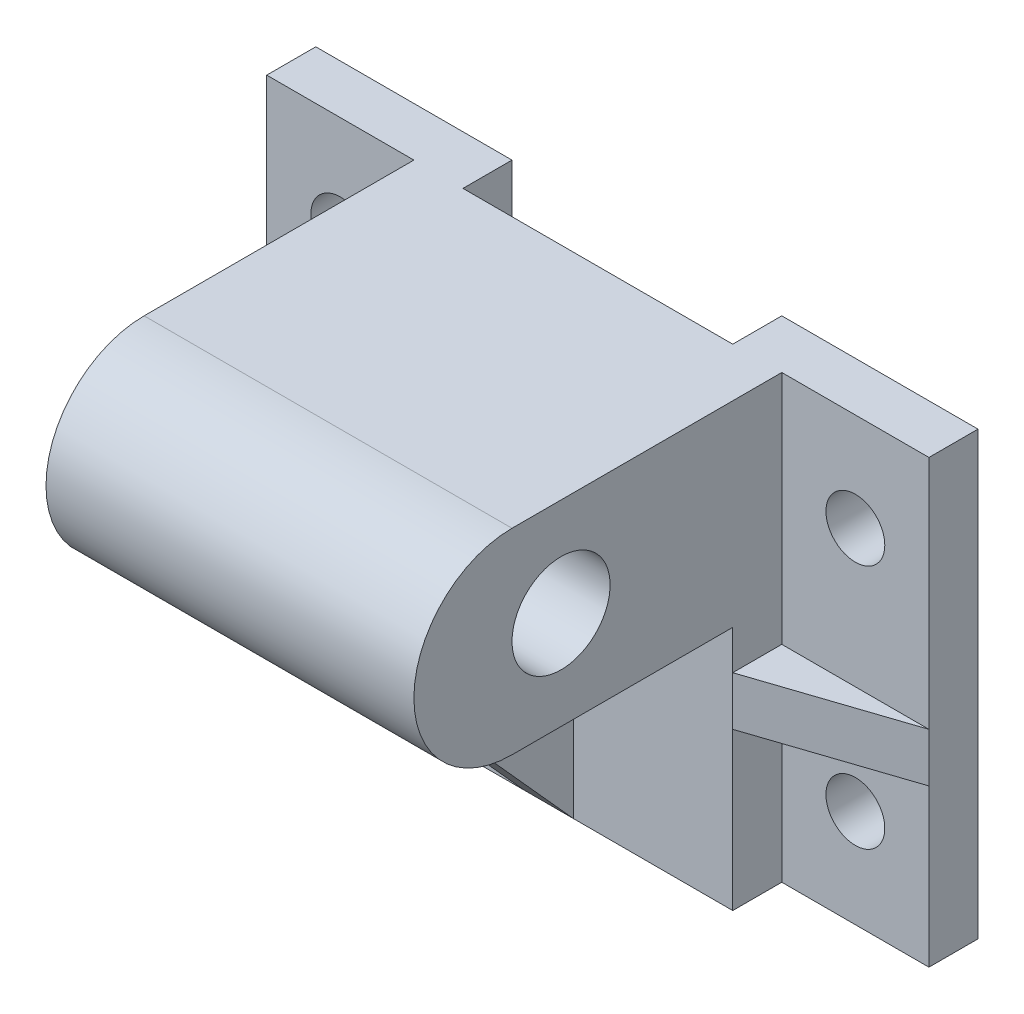
from build123d import *

# Parameters (mm, degrees)
SKETCH1_W           = 75
SKETCH1_H           = 90
BOSS_EXTRUDE1_DEPTH = 10
SKETCH2_W           = 75
SKETCH2_H           = 40
BOSS_EXTRUDE2_DEPTH = 45
SKETCH5_W           = 10
SKETCH5_H           = 90
BOSS_EXTRUDE3_DEPTH = 10
SKETCH7_W           = 10
SKETCH7_H           = 90
BOSS_EXTRUDE4_DEPTH = 30
SKETCH14_R          = 20
BOSS_EXTRUDE6_DEPTH = 75
SKETCH15_R          = 10
CUT_EXTRUDE3_DEPTH  = 75
SKETCH16_R          = 6
CUT_EXTRUDE4_DEPTH  = 75
RIB16_REACH         = 112.482
SKETCH24_WALL_W     = 290.231918176
SKETCH24_WALL_H     = 10
RIB17_REACH         = 115.975
SKETCH25_WALL_W     = 261.572332424
SKETCH25_WALL_H     = 10
RIB18_REACH         = 115.975
SKETCH26_WALL_W     = 261.572332424
SKETCH26_WALL_H     = 10


with BuildPart() as part:
    # Sketch1 → Boss-Extrude1 (new body)
    with BuildSketch(Plane.XY):
        Rectangle(SKETCH1_W, SKETCH1_H)
    extrude(amount=BOSS_EXTRUDE1_DEPTH)

    # Sketch2 → Boss-Extrude2 (add)
    with BuildSketch(Plane.XY.offset(10)):
        with Locations((0, 25)):
            Rectangle(SKETCH2_W, SKETCH2_H)
    extrude(amount=BOSS_EXTRUDE2_DEPTH)

    # Sketch5 → Boss-Extrude3 (add)
    with BuildSketch(Plane(origin=(0, 0, 0), x_dir=(-1, 0, 0), z_dir=(0, 0, -1))):
        with Locations((-32.5, 0)):
            Rectangle(SKETCH5_W, SKETCH5_H)
        with Locations((32.5, 0)):
            Rectangle(SKETCH5_W, SKETCH5_H)
    boss_extrude3 = extrude(amount=BOSS_EXTRUDE3_DEPTH)

    # Sketch7 → Boss-Extrude4 (add)
    with BuildSketch(Plane(origin=(37.5, 0, 0), x_dir=(0, 0, -1), z_dir=(1, 0, 0))):
        with Locations((5, 0)):
            Rectangle(SKETCH7_W, SKETCH7_H)
    boss_extrude4 = extrude(amount=BOSS_EXTRUDE4_DEPTH)

    # Mirror1: Boss-Extrude3, Boss-Extrude4 across plane
    add(boss_extrude3.mirror(Plane(origin=(0, 0, 0), x_dir=(0, 0, 1), z_dir=(1, 0, 0))))
    add(boss_extrude4.mirror(Plane(origin=(0, 0, 0), x_dir=(0, 0, 1), z_dir=(1, 0, 0))))

    # Sketch14 → Boss-Extrude6 (add)
    with BuildSketch(Plane.ZY.offset(37.5)):
        with Locations((55, 25)):
            Circle(SKETCH14_R)
    extrude(amount=-BOSS_EXTRUDE6_DEPTH)

    # Sketch15 → Cut-Extrude3 (cut)
    with BuildSketch(Plane.ZY.offset(37.5)):
        with Locations((45, 25)):
            Circle(SKETCH15_R)
    extrude(amount=-CUT_EXTRUDE3_DEPTH, mode=Mode.SUBTRACT)

    # Sketch16 → Cut-Extrude4 (cut)
    with BuildSketch(Plane.XY):
        with Locations((-52.5, 25)):
            Circle(SKETCH16_R)
        with Locations((52.5, 25)):
            Circle(SKETCH16_R)
        with Locations(Location((52.5, -25, 0), (0, 0, 180))):
            Circle(SKETCH16_R)
        with Locations((-52.5, -25)):
            Circle(SKETCH16_R)
    extrude(amount=-CUT_EXTRUDE4_DEPTH, mode=Mode.SUBTRACT)

    # Sketch24 wall → Rib16 (add, up to next)
    with BuildSketch(Plane(origin=(0, -20, 32.5), x_dir=(0, 0.743294146247, 0.668964731622), z_dir=(0, 0.668964731622, -0.743294146247)), mode=Mode.PRIVATE) as rib16_sk1:
        Rectangle(SKETCH24_WALL_W, SKETCH24_WALL_H)
    rib16_tool1 = extrude(rib16_sk1.sketch, amount=RIB16_REACH, mode=Mode.PRIVATE) - part.part
    add(rib16_tool1.solids().sort_by_distance((0, -20, 32.5))[0])

    # Sketch25 wall → Rib17 (add, up to next)
    with BuildSketch(Plane(origin=(52.5, -8, 5), x_dir=(-0.948683298051, 0, 0.316227766017), z_dir=(-0.316227766017, 0, -0.948683298051)), mode=Mode.PRIVATE) as rib17_sk1:
        Rectangle(SKETCH25_WALL_W, SKETCH25_WALL_H)
    rib17_tool1 = extrude(rib17_sk1.sketch, amount=RIB17_REACH, mode=Mode.PRIVATE) - part.part
    add(rib17_tool1.solids().sort_by_distance((52.5, -8, 5))[0])

    # Sketch26 wall → Rib18 (add, up to next)
    with BuildSketch(Plane(origin=(-52.5, -8, 5), x_dir=(0.948683298051, 0, 0.316227766017), z_dir=(-0.316227766017, 0, 0.948683298051)), mode=Mode.PRIVATE) as rib18_sk1:
        Rectangle(SKETCH26_WALL_W, SKETCH26_WALL_H)
    rib18_tool1 = extrude(rib18_sk1.sketch, amount=-RIB18_REACH, mode=Mode.PRIVATE) - part.part
    add(rib18_tool1.solids().sort_by_distance((-52.5, -8, 5))[0])


solid = part.part
